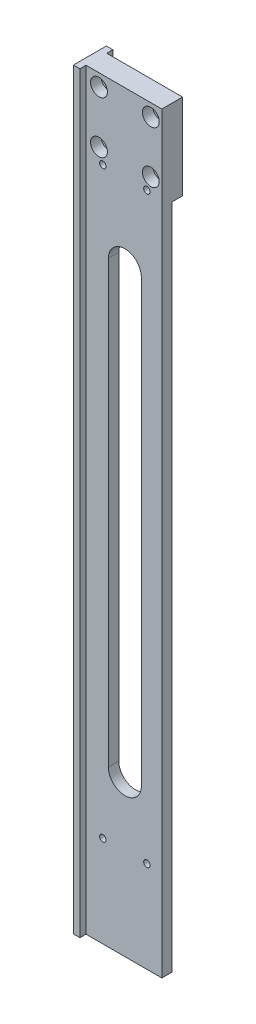
from build123d import *

# Parameters (mm, degrees)
SKETCH1_W                      = 30
SKETCH1_H                      = 290.3
BOSS_EXTRUDE1_DEPTH            = 8
SKETCH1_3_W                    = 2.5
SKETCH1_3_H                    = 290.3
BOSS_EXTRUDE2_DEPTH            = 10.35
SKETCH1_6_W                    = 2.5
SKETCH1_6_H                    = 290.3
BOSS_EXTRUDE3_DEPTH            = 2.35
CBORE_FOR_M3_SHCS1_D           = 3.6
CBORE_FOR_M3_SHCS1_CBORE_D     = 6.5
CBORE_FOR_M3_SHCS1_CBORE_DEPTH = 4
M3X0_5_TAPPED_HOLE1_D          = 2.5
CUT_EXTRUDE1_DEPTH             = 10
SKETCH12_W                     = 0.75
SKETCH12_H                     = 290.3
CUT_EXTRUDE2_DEPTH             = 147.567032446
SKETCH15_W                     = 31.75
SKETCH15_H                     = 257.3
CUT_EXTRUDE3_DEPTH             = 4
CUT_EXTRUDE3_DIRECTION_2_REACH = 148.567


with BuildPart() as part:
    # Sketch1 → Boss-Extrude1 (new body)
    with BuildSketch(Plane.XY):
        Rectangle(SKETCH1_W, SKETCH1_H)
    extrude(amount=BOSS_EXTRUDE1_DEPTH)

    # Sketch1<3> → Boss-Extrude2 (add)
    with BuildSketch(Plane.XY):
        with Locations((-16.25, 0)):
            Rectangle(SKETCH1_3_W, SKETCH1_3_H)
    extrude(amount=BOSS_EXTRUDE2_DEPTH)

    # Sketch1<6> → Boss-Extrude3 (add)
    with BuildSketch(Plane.XY):
        with Locations((-16.25, 0)):
            Rectangle(SKETCH1_6_W, SKETCH1_6_H)
    extrude(amount=-BOSS_EXTRUDE3_DEPTH)

    # CBORE for M3 SHCS1 (through all)
    with Locations(Plane.XY.offset(8)):
        with Locations((-10, 140.35), (10, 140.35), (10, 120.35), (-10, 120.35)):
            CounterBoreHole(CBORE_FOR_M3_SHCS1_D / 2, CBORE_FOR_M3_SHCS1_CBORE_D / 2, CBORE_FOR_M3_SHCS1_CBORE_DEPTH)

    # M3x0.5 Tapped Hole1 (through all)
    with Locations(Plane.XY.offset(8)):
        with Locations((-8.5, 115.15), (8.5, 115.15), (8.5, -109.85), (-8.5, -109.85)):
            Hole(M3X0_5_TAPPED_HOLE1_D / 2)

    # Sketch11 → Cut-Extrude1 (cut)
    with BuildSketch(Plane.XY.offset(8)):
        with BuildLine():
            Line((-6.35, -85), (-6.35, 85))
            ThreePointArc((-6.35, 85), (0, 91.35), (6.35, 85))
            Line((6.35, 85), (6.35, -85))
            ThreePointArc((6.35, -85), (0, -91.35), (-6.35, -85))
        make_face()
    extrude(amount=-CUT_EXTRUDE1_DEPTH, mode=Mode.SUBTRACT)

    # Sketch12 → Cut-Extrude2 (cut, through all)
    with BuildSketch(Plane.XY.offset(8)):
        with Locations((14.625, 0)):
            Rectangle(SKETCH12_W, SKETCH12_H)
    extrude(amount=-CUT_EXTRUDE2_DEPTH, mode=Mode.SUBTRACT)

    # Sketch15 → Cut-Extrude3 (cut)
    with BuildSketch(Plane(origin=(0, 0, 0), x_dir=(-1, 0, 0), z_dir=(0, 0, -1))):
        with Locations((1.625, -16.5)):
            Rectangle(SKETCH15_W, SKETCH15_H)
    extrude(amount=-CUT_EXTRUDE3_DEPTH, mode=Mode.SUBTRACT)

    # Cut-Extrude3 direction 2: up to this face of the body (flat: up to its plane)
    cut_extrude3_direction_2_end = Plane(part.part.faces().sort_by_distance((-16.25, 0, -2.35))[0])
    # Sketch15 → Cut-Extrude3 direction 2 (cut, up to the picked face)
    with BuildSketch(Plane(origin=(0, 0, 0), x_dir=(-1, 0, 0), z_dir=(0, 0, -1)), mode=Mode.PRIVATE) as cut_extrude3_direction_2_sk1:
        with Locations((1.625, -16.5)):
            Rectangle(SKETCH15_W, SKETCH15_H)
    cut_extrude3_direction_2_tool1 = split(extrude(cut_extrude3_direction_2_sk1.sketch, amount=CUT_EXTRUDE3_DIRECTION_2_REACH, mode=Mode.PRIVATE), bisect_by=cut_extrude3_direction_2_end, keep=Keep.BOTH, mode=Mode.PRIVATE)
    add(cut_extrude3_direction_2_tool1.solids().sort_by(Axis((-1.625, -16.5, 0), (0, 0, -1)))[0], mode=Mode.SUBTRACT)


solid = part.part
